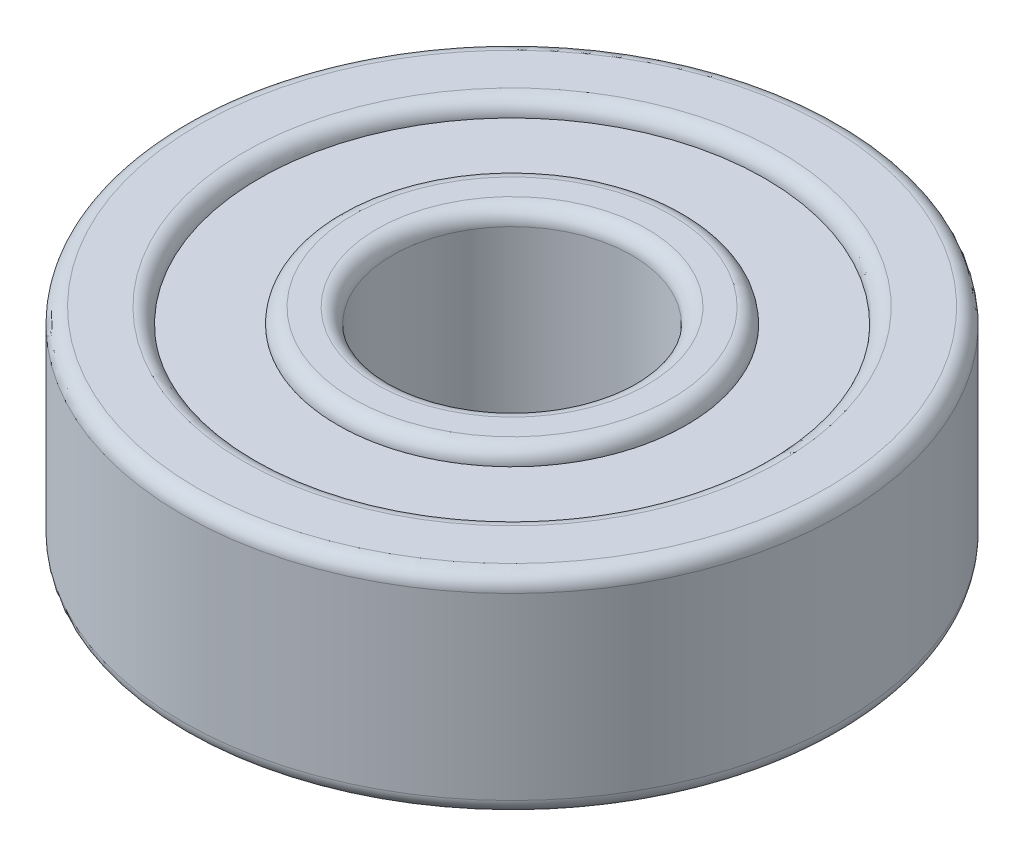
from build123d import *

# Parameters (mm, degrees)
SKETCH1_R           = 11.0000034
SKETCH1_R_2         = 4.0000047
BOSS_EXTRUDE1_DEPTH = 3.5000057
SKETCH2_R           = 8.4400009
SKETCH2_R_2         = 5.8200036
CUT_EXTRUDE1_DEPTH  = 18.058731172
SKETCH3_R           = 2.3300055
FILLET1_R           = 0.508
FILLET2_R           = 0.508
CIRPATTERN2_COUNT   = 7
BOSS_EXTRUDE4_START = 2.01495
SKETCH5_R           = 8.4400009
SKETCH5_R_2         = 5.8200036
BOSS_EXTRUDE4_DEPTH = 0.977055288


with BuildPart() as part:
    # Sketch1 → Boss-Extrude1 (new, symmetric)
    with BuildSketch(Plane(origin=(0, 0, 0), x_dir=(1, 0, 0), z_dir=(0, 1, 0))):
        with Locations(Location((0, 0, 0), (0, 0, 270))):
            Circle(SKETCH1_R)
        with Locations(Location((0, 0, 0), (0, 0, 270))):
            Circle(SKETCH1_R_2, mode=Mode.SUBTRACT)
    extrude(amount=BOSS_EXTRUDE1_DEPTH, both=True)

    # Sketch2 → Cut-Extrude1 (cut, through all)
    with BuildSketch(Plane(origin=(0, 3.5000057, 0), x_dir=(1, 0, 0), z_dir=(0, 1, 0))):
        with Locations(Location((0, 0, 0), (0, 0, 270))):
            Circle(SKETCH2_R)
        with Locations(Location((0, 0, 0), (0, 0, 270))):
            Circle(SKETCH2_R_2, mode=Mode.SUBTRACT)
    extrude(amount=-CUT_EXTRUDE1_DEPTH, mode=Mode.SUBTRACT)


with BuildPart() as cut_extrude1_piece_1:
    # of the separate pieces the step leaves, piece 1, a body of its own (cut_extrude1_pieces)
    add(part.part.solids().sort_by_distance((0, -3.5000057, 11.0000034))[0])


with BuildPart() as cut_extrude1_piece_2:
    # of the separate pieces the step leaves, piece 2, a body of its own (cut_extrude1_pieces)
    add(part.part.solids().sort_by_distance((0, -3.5000057, 5.8200036))[0])


with BuildPart() as cut_revolve1_tool:
    # Sketch3 → Cut-Revolve1 (revolve)
    with BuildSketch(Plane(origin=(0, 0, 0), x_dir=(0, 0, -1), z_dir=(1, 0, 0))):
        with Locations((7.2700007, 0)):
            Circle(SKETCH3_R)
    revolve(axis=Axis((0, 8.468633392, 0), (0, -1, 0)))


with BuildPart() as cut_extrude1_piece_1_1:
    add(cut_extrude1_piece_1.part)

    # Cut-Revolve1: cut by cut_revolve1_tool
    add(cut_revolve1_tool.part, mode=Mode.SUBTRACT)

    # Fillet1
    fillet1_edges = [cut_extrude1_piece_1_1.edges().sort_by_distance(p)[0] for p in [
        (0, -3.5000057, -8.4400009),
        (0, -3.5000057, -11.0000034),
        (0, 3.5000057, -8.4400009),
        (0, 3.5000057, -11.0000034),
    ]]
    fillet(fillet1_edges, radius=FILLET1_R)


with BuildPart() as cut_extrude1_piece_2_1:
    add(cut_extrude1_piece_2.part)

    # Cut-Revolve1: cut by cut_revolve1_tool
    add(cut_revolve1_tool.part, mode=Mode.SUBTRACT)

    # Fillet2
    fillet2_edges = [cut_extrude1_piece_2_1.edges().sort_by_distance(p)[0] for p in [
        (0, -3.5000057, -5.8200036),
        (0, 3.5000057, -5.8200036),
        (0, -3.5000057, -4.0000047),
        (0, 3.5000057, -4.0000047),
    ]]
    fillet(fillet2_edges, radius=FILLET2_R)


with BuildPart() as body_3:
    # Sketch4 → Revolve1 (revolve)
    with BuildSketch(Plane(origin=(0, 0, 0), x_dir=(0, 0, -1), z_dir=(1, 0, 0))):
        with BuildLine():
            Line((7.2700007, 2.3300055), (7.2700007, -2.3300055))
            ThreePointArc((7.2700007, -2.3300055), (9.6000062, 0), (7.2700007, 2.3300055))
        make_face()
    revolve(axis=Axis((0, 8.508066945, -7.2700007), (0, -1, 0)))


with BuildPart() as cirpattern2_1:
    # CirPattern2: pattern copy
    add(body_3.part.rotate(Axis((0, 0, 0), (0, 1, 0)), 1 * 360 / CIRPATTERN2_COUNT))


with BuildPart() as cirpattern2_2:
    # CirPattern2: pattern copy
    add(body_3.part.rotate(Axis((0, 0, 0), (0, 1, 0)), 2 * 360 / CIRPATTERN2_COUNT))


with BuildPart() as cirpattern2_3:
    # CirPattern2: pattern copy
    add(body_3.part.rotate(Axis((0, 0, 0), (0, 1, 0)), 3 * 360 / CIRPATTERN2_COUNT))


with BuildPart() as cirpattern2_4:
    # CirPattern2: pattern copy
    add(body_3.part.rotate(Axis((0, 0, 0), (0, 1, 0)), 4 * 360 / CIRPATTERN2_COUNT))


with BuildPart() as cirpattern2_5:
    # CirPattern2: pattern copy
    add(body_3.part.rotate(Axis((0, 0, 0), (0, 1, 0)), 5 * 360 / CIRPATTERN2_COUNT))


with BuildPart() as cirpattern2_6:
    # CirPattern2: pattern copy
    add(body_3.part.rotate(Axis((0, 0, 0), (0, 1, 0)), 6 * 360 / CIRPATTERN2_COUNT))


with BuildPart() as body_10:
    # Sketch5 → Boss-Extrude4 (new body)
    with BuildSketch(Plane(origin=(0, 0, 0), x_dir=(1, 0, 0), z_dir=(0, 1, 0)).offset(BOSS_EXTRUDE4_START)):
        with Locations(Location((0, 0, 0), (0, 0, 90))):
            Circle(SKETCH5_R)
        with Locations(Location((0, 0, 0), (0, 0, 90))):
            Circle(SKETCH5_R_2, mode=Mode.SUBTRACT)
    extrude(amount=BOSS_EXTRUDE4_DEPTH)


with BuildPart() as body_11:
    # Mirror1: mirrored copy
    add(body_10.part.mirror(Plane.ZX))


solid = Compound([cut_extrude1_piece_1_1.part, cut_extrude1_piece_2_1.part, body_3.part, cirpattern2_1.part, cirpattern2_2.part, cirpattern2_3.part, cirpattern2_4.part, cirpattern2_5.part, cirpattern2_6.part, body_10.part, body_11.part])
